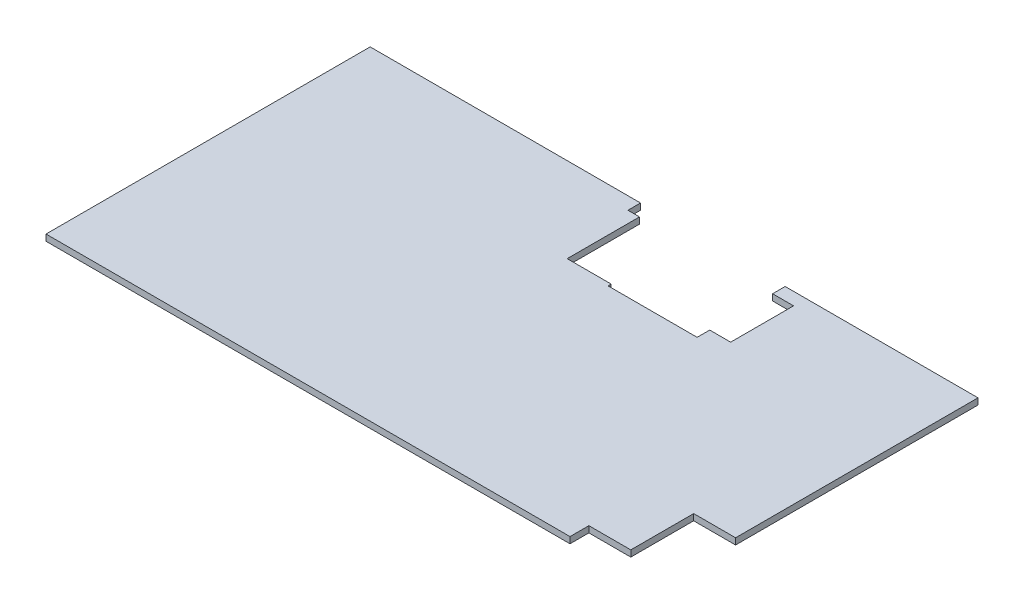
from build123d import *

# Parameters (mm, degrees)
SKETCH1_W           = 290
SKETCH1_H           = 154.65
BOSS_EXTRUDE1_DEPTH = 3
CUT_EXTRUDE1_DEPTH  = 165.356793669
SKETCH3_W           = 10
SKETCH3_H           = 15
CUT_EXTRUDE2_DEPTH  = 3
SKETCH5_W           = 40
SKETCH5_H           = 9
CUT_EXTRUDE3_DEPTH  = 3
SKETCH6_W           = 20
SKETCH6_H           = 30
CUT_EXTRUDE4_DEPTH  = 3


with BuildPart() as part:
    # Sketch1 → Boss-Extrude1 (new body)
    with BuildSketch(Plane(origin=(0, 0, 0), x_dir=(1, 0, 0), z_dir=(0, 1, 0))):
        Rectangle(SKETCH1_W, SKETCH1_H)
    extrude(amount=BOSS_EXTRUDE1_DEPTH)

    # Sketch2 → Cut-Extrude1 (cut, through all)
    with BuildSketch(Plane(origin=(0, 3, 0), x_dir=(1, 0, 0), z_dir=(0, 1, 0))):
        Polygon((53, 77.325), (-16, 77.325), (-16, 71.325), (-10.5, 71.325), (-10.5, 36.825), (10.5, 36.825), (10.5, 35.325), (19.5, 35.325), (39.5, 35.325), (53, 35.325), align=None)
    extrude(amount=-CUT_EXTRUDE1_DEPTH, mode=Mode.SUBTRACT)

    # Sketch3 → Cut-Extrude2 (cut)
    with BuildSketch(Plane(origin=(0, 3, 0), x_dir=(1, 0, 0), z_dir=(0, 1, 0))):
        with Locations((58, 63.825)):
            Rectangle(SKETCH3_W, SKETCH3_H)
        with Locations((58, 48.825)):
            Rectangle(SKETCH3_W, SKETCH3_H)
    extrude(amount=-CUT_EXTRUDE2_DEPTH, mode=Mode.SUBTRACT)

    # Sketch5 → Cut-Extrude3 (cut)
    with BuildSketch(Plane(origin=(0, 0, 0), x_dir=(-1, 0, 0), z_dir=(0, -1, 0))):
        with Locations((-125, -72.825)):
            Rectangle(SKETCH5_W, SKETCH5_H)
    extrude(amount=-CUT_EXTRUDE3_DEPTH, mode=Mode.SUBTRACT)

    # Sketch6 → Cut-Extrude4 (cut)
    with BuildSketch(Plane(origin=(0, 3, 0), x_dir=(1, 0, 0), z_dir=(0, 1, 0))):
        with Locations((135, -53.325)):
            Rectangle(SKETCH6_W, SKETCH6_H)
    extrude(amount=-CUT_EXTRUDE4_DEPTH, mode=Mode.SUBTRACT)


solid = part.part
